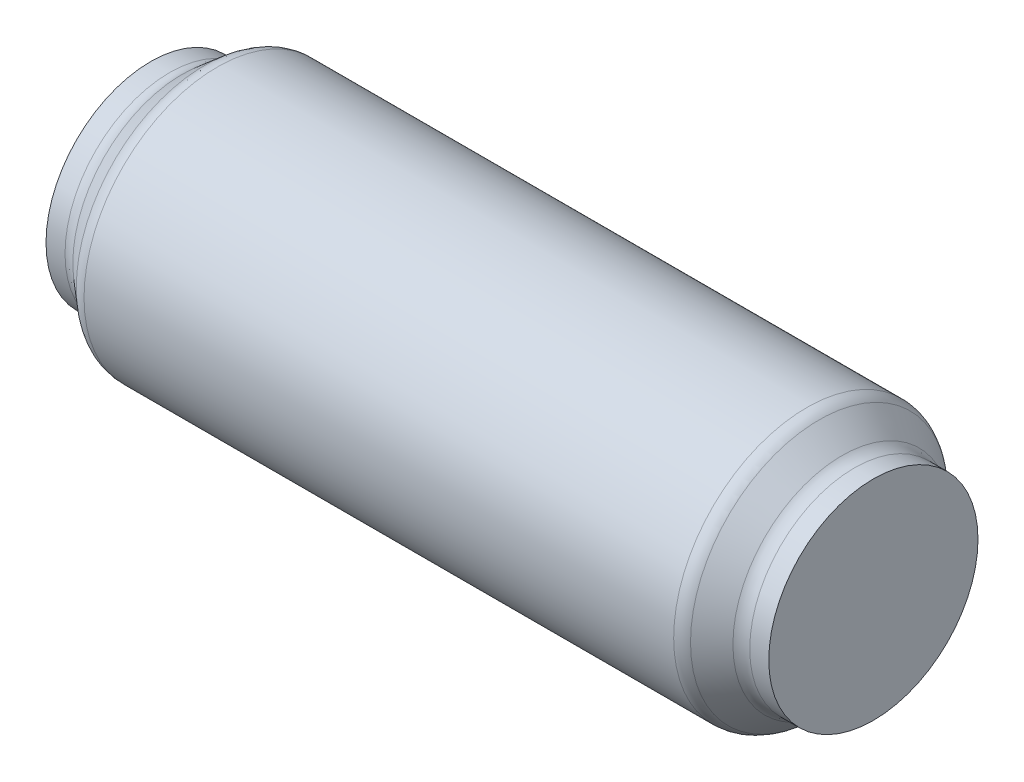
from build123d import *


with BuildPart() as part:
    # Sketch1 → Revolve1 (revolve)
    with BuildSketch(Plane(origin=(0, 0, 0), x_dir=(1, 0, 0), z_dir=(0, 1, 0))):
        with BuildLine():
            Line((95, 0), (95, 27.5))
            Line((95, 27.5), (90, 27.5))
            ThreePointArc((90, 27.5), (88.27509592, 27.80695132), (86.761976473, 28.690117634))
            Line((86.761976473, 28.690117634), (80.738023527, 33.809882366))
            ThreePointArc((80.738023527, 33.809882366), (79.22490408, 34.69304868), (77.5, 35))
            Line((77.5, 35), (-77.5, 35))
            ThreePointArc((-77.5, 35), (-79.22490408, 34.69304868), (-80.738023527, 33.809882366))
            Line((-80.738023527, 33.809882366), (-86.761976473, 28.690117634))
            ThreePointArc((-86.761976473, 28.690117634), (-88.27509592, 27.80695132), (-90, 27.5))
            Line((-90, 27.5), (-95, 27.5))
            Line((-95, 27.5), (-95, 0))
            Line((-95, 0), (95, 0))
        make_face()
    revolve(axis=Axis((-95, 0, 0), (1, 0, 0)))


solid = part.part
